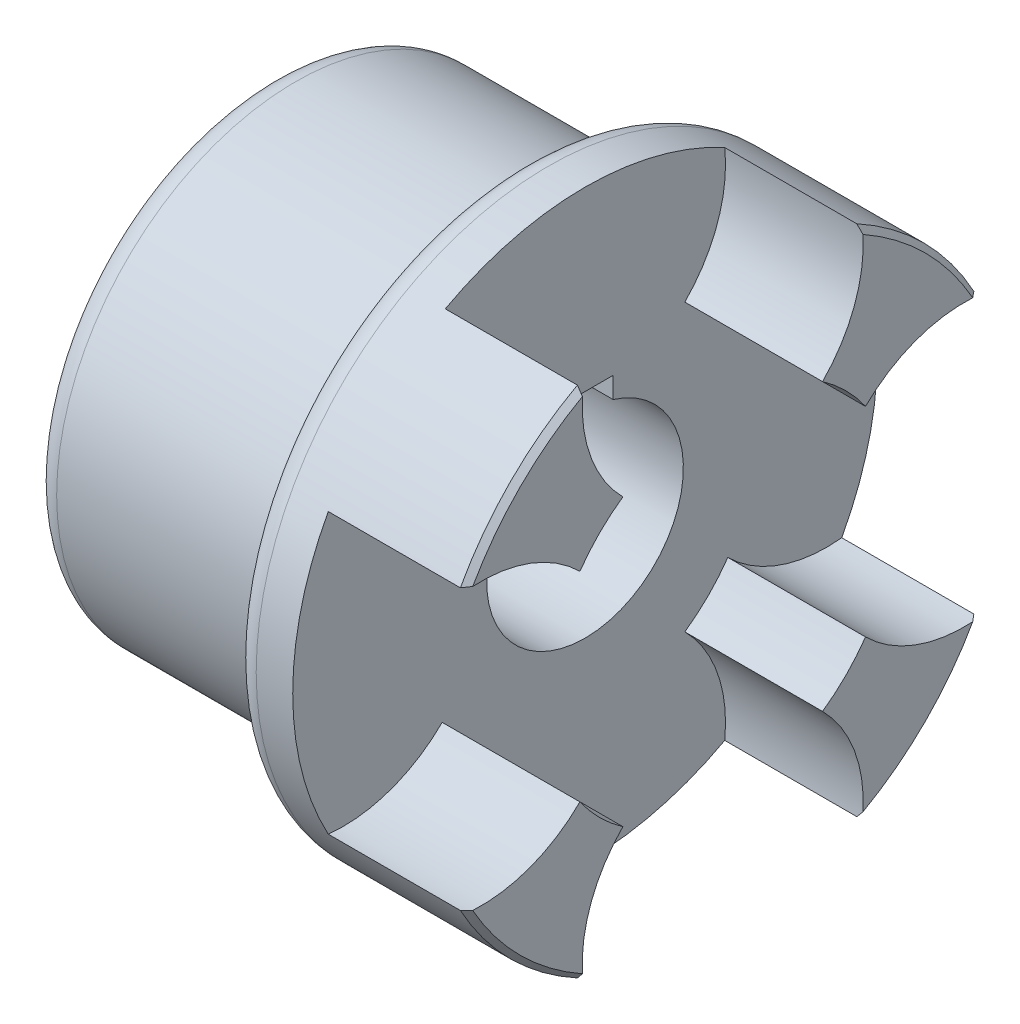
from build123d import *

# Parameters (mm, degrees)
CUT_EXTRUDE_1_DEPTH = 24.5
SKETCH_4_W          = 10
SKETCH_4_H          = 7.054294233
CUT_EXTRUDE_2_DEPTH = 109.585993287


with BuildPart() as part:
    # Эскиз1 → Повернуть1 (revolve)
    with BuildSketch(Plane.XY, mode=Mode.PRIVATE) as revolve_1_sk:
        with BuildLine():
            Line((-70.245087719, -6.642192982), (-70.245087719, 12.857807018))
            ThreePointArc((-70.245087719, 12.857807018), (-68.927068235, 16.039787533), (-65.745087719, 17.357807018))
            Line((-65.745087719, 17.357807018), (-29.745087719, 17.357807018))
            ThreePointArc((-29.745087719, 17.357807018), (-26.563107204, 18.675826502), (-25.245087719, 21.857807018))
            Line((-25.245087719, 21.857807018), (-25.245087719, 22.357807018))
            ThreePointArc((-25.245087719, 22.357807018), (-23.927068235, 25.539787533), (-20.745087719, 26.857807018))
            Line((-20.745087719, 26.857807018), (9.254912281, 26.857807018))
            Line((9.254912281, 26.857807018), (10.254912281, 25.857807018))
            Line((10.254912281, 25.857807018), (10.254912281, -6.642192982))
            Line((10.254912281, -6.642192982), (9.254912281, -7.642192982))
            Line((9.254912281, -7.642192982), (-69.245087719, -7.642192982))
            Line((-69.245087719, -7.642192982), (-70.245087719, -6.642192982))
        make_face()
    revolve(revolve_1_sk.sketch.rotate(Axis((-70.245087719, -25.142192982, 0), (1, 0, 0)), 90), axis=Axis((-70.245087719, -25.142192982, 0), (1, 0, 0)))

    # Эскиз3 → Вырез-Вытянуть1 (cut)
    with BuildSketch(Plane(origin=(10.254912281, 0, 0), x_dir=(0, 0, -1), z_dir=(1, 0, 0))):
        with BuildLine():
            ThreePointArc((-17.761912417, -50.549169727), (0, -93.142192982), (17.761912417, -50.549169727))
            ThreePointArc((17.761912417, -50.549169727), (21.920310217, -47.062503199), (25.406976744, -42.9041054))
            ThreePointArc((25.406976744, -42.9041054), (68, -25.142192982), (25.406976744, -7.380280565))
            ThreePointArc((25.406976744, -7.380280565), (21.920310217, -3.221882766), (17.761912417, 0.264783762))
            ThreePointArc((17.761912417, 0.264783762), (0, 42.857807018), (-17.761912417, 0.264783762))
            ThreePointArc((-17.761912417, 0.264783762), (-21.920310217, -3.221882766), (-25.406976744, -7.380280565))
            ThreePointArc((-25.406976744, -7.380280565), (-68, -25.142192982), (-25.406976744, -42.9041054))
            ThreePointArc((-25.406976744, -42.9041054), (-21.920310217, -47.062503199), (-17.761912417, -50.549169727))
        make_face()
    extrude(amount=-CUT_EXTRUDE_1_DEPTH, mode=Mode.SUBTRACT)

    # Эскиз4 → Вырез-Вытянуть2 (cut, through all)
    with BuildSketch(Plane(origin=(-14.245087719, 0, 0), x_dir=(0, 0, -1), z_dir=(1, 0, 0))):
        with Locations((0, -8.169340099)):
            Rectangle(SKETCH_4_W, SKETCH_4_H)
    extrude(amount=-CUT_EXTRUDE_2_DEPTH, mode=Mode.SUBTRACT)


solid = part.part
